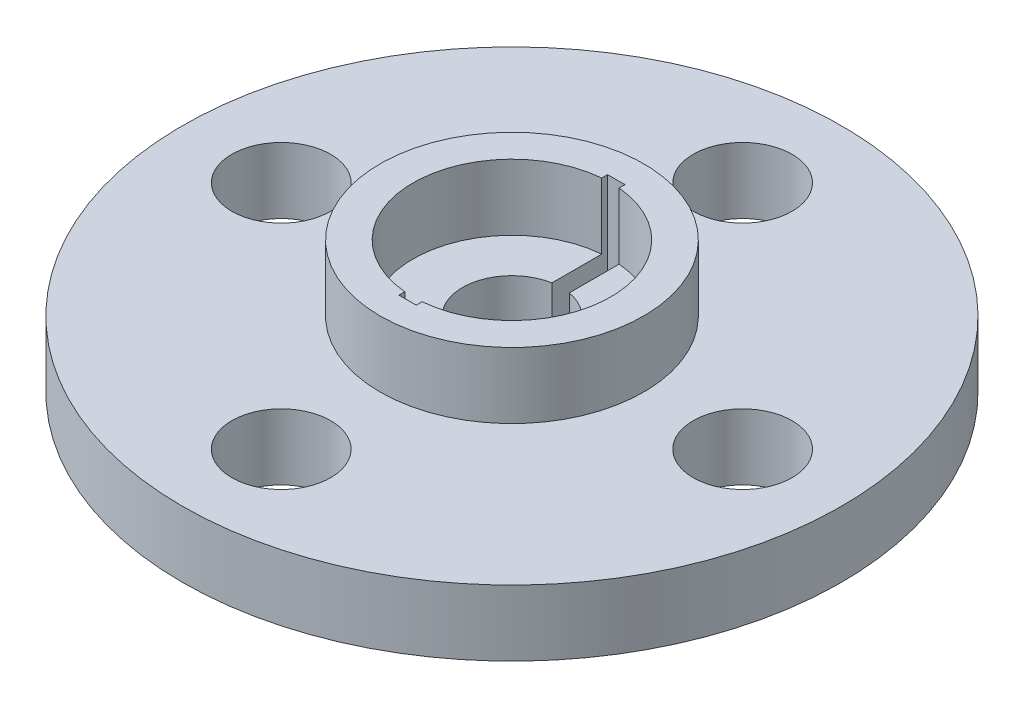
from build123d import *

# Parameters (mm, degrees)
SKETCH_1_R          = 10
SKETCH_1_R_2        = 1.5
EXTRUDE_1_DEPTH     = 2
SKETCH_2_R          = 4
SKETCH_2_R_2        = 3
EXTRUDE_2_DEPTH     = 2
SKETCH_3_W          = 0.526425496
SKETCH_3_H          = 6.332921184
CUT_EXTRUDE_1_DEPTH = 4


with BuildPart() as part:
    # 草图1 → 凸台-拉伸1 (new body)
    with BuildSketch(Plane(origin=(0, 0, 0), x_dir=(1, 0, 0), z_dir=(0, 1, 0))):
        with Locations(Location((0, 0, 0), (0, 0, 270))):
            Circle(SKETCH_1_R)
        with Locations(Location((7, 0, 0), (0, 0, 270))):
            Circle(SKETCH_1_R_2, mode=Mode.SUBTRACT)
        with Locations(Location((0, 0, 0), (0, 0, 270))):
            Circle(SKETCH_1_R_2, mode=Mode.SUBTRACT)
        with Locations(Location((0, -7, 0), (0, 0, 270))):
            Circle(SKETCH_1_R_2, mode=Mode.SUBTRACT)
        with Locations(Location((-7, 0, 0), (0, 0, 270))):
            Circle(SKETCH_1_R_2, mode=Mode.SUBTRACT)
        with Locations(Location((0, 7, 0), (0, 0, 270))):
            Circle(SKETCH_1_R_2, mode=Mode.SUBTRACT)
    extrude(amount=EXTRUDE_1_DEPTH)

    # 草图2 → 凸台-拉伸2 (add)
    with BuildSketch(Plane(origin=(0, 2, 0), x_dir=(1, 0, 0), z_dir=(0, 1, 0))):
        with Locations(Location((0, 0, 0), (0, 0, 270))):
            Circle(SKETCH_2_R)
        with Locations(Location((0, 0, 0), (0, 0, 270))):
            Circle(SKETCH_2_R_2, mode=Mode.SUBTRACT)
    extrude(amount=EXTRUDE_2_DEPTH)

    # 草图3 → 切除-拉伸1 (cut)
    with BuildSketch(Plane.XZ):
        Rectangle(SKETCH_3_W, SKETCH_3_H)
    extrude(amount=-CUT_EXTRUDE_1_DEPTH, mode=Mode.SUBTRACT)


solid = part.part
